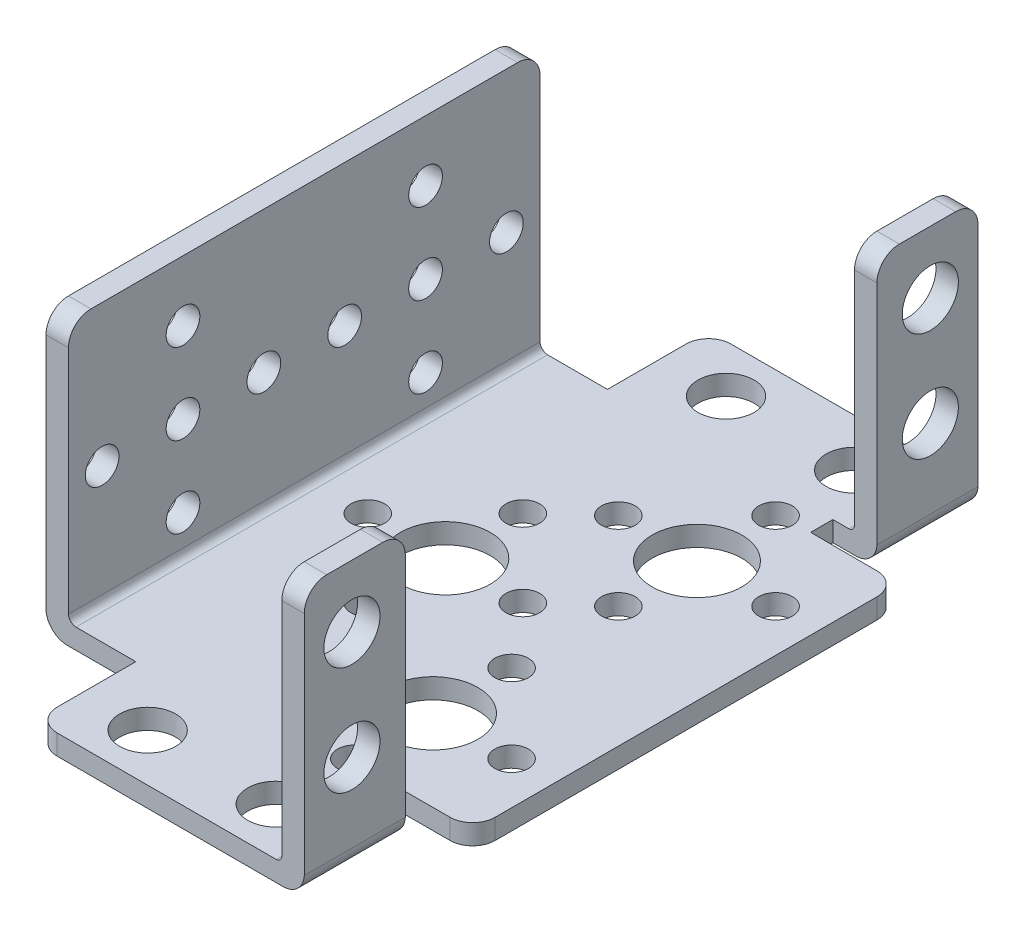
from build123d import *

# Parameters (mm, degrees)
BOSS_EXTRUDE1_DEPTH  = 42
FILLET1_R            = 2
BOSS_EXTRUDE2_DEPTH  = 9
FILLET2_R            = 2
CUT_EXTRUDE1_DEPTH   = 9
FILLET3_R            = 2
FILLET2_OF_MIRROR3_R = 2
FILLET3_OF_MIRROR3_R = 2
SKETCH5_R            = 1.5
CUT_EXTRUDE2_DEPTH   = 9
SKETCH7_R            = 2.5
CUT_EXTRUDE3_DEPTH   = 9
SKETCH8_R            = 2.5
CUT_EXTRUDE4_DEPTH   = 9
SKETCH9_R            = 4
SKETCH9_R_2          = 1.5
CUT_EXTRUDE5_DEPTH   = 9
SKETCH10_R           = 1.5
SKETCH10_R_2         = 4
CUT_EXTRUDE6_DEPTH   = 9


with BuildPart() as part:
    # Sketch2 → Boss-Extrude1 (new body)
    with BuildSketch(Plane.XY):
        with BuildLine():
            ThreePointArc((0, 1.792201759), (0.553343721, 0.553343721), (1.792201759, 0))
            Line((1.792201759, 0), (2, 0))
            Line((2, 0), (36, 0))
            Line((36, 0), (36, 1.792224077))
            Line((36, 1.792224077), (2.665691545, 1.792224077))
            ThreePointArc((2.665691545, 1.792224077), (2.206352155, 1.99856094), (2, 2.45789346))
            Line((2, 2.45789346), (2, 25))
            Line((2, 25), (0, 25))
            Line((0, 25), (0, 1.792201759))
        make_face()
    extrude(amount=BOSS_EXTRUDE1_DEPTH)

    # Fillet1
    fillet1_edges = [part.edges().sort_by_distance(p)[0] for p in [
        (1, 25, 0),
        (1, 25, 42),
        (36, 0.896112038, 42),
        (36, 0.896112038, 0),
    ]]
    fillet(fillet1_edges, radius=FILLET1_R)

    # Sketch3 → Boss-Extrude2 (add)
    with BuildSketch(Plane(origin=(0, 0, 0), x_dir=(-1, 0, 0), z_dir=(0, 0, -1))):
        with BuildLine():
            Line((-32, 1.792224077), (-29.505638958, 1.792224077))
            ThreePointArc((-29.505638958, 1.792224077), (-29.847420209, 1.944803868), (-30, 2.286585119))
            Line((-30, 2.286585119), (-30, 24))
            Line((-30, 24), (-32, 24))
            Line((-32, 24), (-32, 1.792224077))
        make_face()
        with BuildLine():
            Line((-8, 0), (-8, 1.792224077))
            Line((-8, 1.792224077), (-29.505638958, 1.792224077))
            Line((-29.505638958, 1.792224077), (-32, 1.792224077))
            ThreePointArc((-32, 1.792224077), (-31.446652567, 0.553347433), (-30.207775923, 0))
            Line((-30.207775923, 0), (-30, 0))
            Line((-30, 0), (-8, 0))
        make_face()
    boss_extrude2 = extrude(amount=BOSS_EXTRUDE2_DEPTH)

    # Fillet2
    fillet2_edges = [part.edges().sort_by_distance(p)[0] for p in [
        (8, 0.896112038, -9),
        (31, 24, -9),
        (31, 24, 0),
    ]]
    fillet(fillet2_edges, radius=FILLET2_R)

    # Sketch4 → Cut-Extrude1 (cut)
    with BuildSketch(Plane(origin=(0, 1.792224077, 0), x_dir=(1, 0, 0), z_dir=(0, 1, 0))):
        with BuildLine():
            Line((28.075602478, 0), (28.075602478, -1.97807902))
            Line((28.075602478, -1.97807902), (36, -2))
            ThreePointArc((36, -2), (35.415834928, -0.584165072), (34, 0))
            Line((34, 0), (28.075602478, 0))
        make_face()
    cut_extrude1 = extrude(amount=-CUT_EXTRUDE1_DEPTH, mode=Mode.SUBTRACT)

    # Fillet3
    fillet3_edges = [part.edges().sort_by_distance(p)[0] for p in [
        (36, 0.896112038, 2),
    ]]
    fillet(fillet3_edges, radius=FILLET3_R)

    # Mirror3: Boss-Extrude2, Cut-Extrude1 across plane
    add(boss_extrude2.mirror(Plane(origin=(0, 0, 21), x_dir=(1, 0, 0), z_dir=(0, 0, -1))))
    add(cut_extrude1.mirror(Plane(origin=(0, 0, 21), x_dir=(1, 0, 0), z_dir=(0, 0, -1))), mode=Mode.SUBTRACT)

    # Fillet2 of Mirror3
    fillet2_of_mirror3_edges = [part.edges().sort_by_distance(p)[0] for p in [
        (8, 0.896112038, 51),
        (31, 24, 51),
        (31, 24, 42),
    ]]
    fillet(fillet2_of_mirror3_edges, radius=FILLET2_OF_MIRROR3_R)

    # Fillet3 of Mirror3
    fillet3_of_mirror3_edges = [part.edges().sort_by_distance(p)[0] for p in [
        (36, 0.896112038, 40),
    ]]
    fillet(fillet3_of_mirror3_edges, radius=FILLET3_OF_MIRROR3_R)

    # Sketch5 → Cut-Extrude2 (cut)
    with BuildSketch(Plane.ZY):
        with Locations((39, 12.396100879)):
            Circle(SKETCH5_R)
        with Locations((31.8, 12.396100879)):
            Circle(SKETCH5_R)
        with Locations((24.6, 12.396100879)):
            Circle(SKETCH5_R)
        with Locations((17.4, 12.396100879)):
            Circle(SKETCH5_R)
        with Locations((10.2, 12.396100879)):
            Circle(SKETCH5_R)
        with Locations((3, 12.396100879)):
            Circle(SKETCH5_R)
        with Locations((31.8, 19.596100879)):
            Circle(SKETCH5_R)
        with Locations((31.8, 5.196100879)):
            Circle(SKETCH5_R)
        with Locations((10.2, 19.596100879)):
            Circle(SKETCH5_R)
        with Locations((10.2, 5.196100879)):
            Circle(SKETCH5_R)
    extrude(amount=-CUT_EXTRUDE2_DEPTH, mode=Mode.SUBTRACT)

    # Sketch7 → Cut-Extrude3 (cut)
    with BuildSketch(Plane(origin=(0, 1.792224077, 0), x_dir=(1, 0, 0), z_dir=(0, 1, 0))):
        with Locations(Location((25.217307954, -46.754456755, 0), (0, 0, 270))):
            Circle(SKETCH7_R)
        with Locations(Location((13.806043378, -46.754456755, 0), (0, 0, 270))):
            Circle(SKETCH7_R)
    cut_extrude3 = extrude(amount=-CUT_EXTRUDE3_DEPTH, mode=Mode.SUBTRACT)

    # Mirror4: Cut-Extrude3 across plane
    add(cut_extrude3.mirror(Plane(origin=(0, 0, 21), x_dir=(1, 0, 0), z_dir=(0, 0, -1))), mode=Mode.SUBTRACT)

    # Sketch8 → Cut-Extrude4 (cut)
    with BuildSketch(Plane.ZY.offset(-30)):
        with Locations((46.754456755, 18.460059087)):
            Circle(SKETCH8_R)
        with Locations((46.754456755, 8.801060864)):
            Circle(SKETCH8_R)
    cut_extrude4 = extrude(amount=-CUT_EXTRUDE4_DEPTH, mode=Mode.SUBTRACT)

    # Mirror5: Cut-Extrude4 across plane
    add(cut_extrude4.mirror(Plane(origin=(0, 0, 21), x_dir=(1, 0, 0), z_dir=(0, 0, -1))), mode=Mode.SUBTRACT)

    # Sketch9 → Cut-Extrude5 (cut)
    with BuildSketch(Plane(origin=(0, 1.792224077, 0), x_dir=(1, 0, 0), z_dir=(0, 1, 0))):
        with Locations(Location((25.217307954, -9.245543245, 0), (0, 0, 270))):
            Circle(SKETCH9_R)
        with Locations(Location((25.217307954, -2.245543245, 0), (0, 0, 270))):
            Circle(SKETCH9_R_2)
        with Locations(Location((32.217307954, -9.245543245, 0), (0, 0, 270))):
            Circle(SKETCH9_R_2)
        with Locations(Location((25.217307954, -16.245543245, 0), (0, 0, 270))):
            Circle(SKETCH9_R_2)
        with Locations(Location((18.217307954, -9.245543245, 0), (0, 0, 270))):
            Circle(SKETCH9_R_2)
    cut_extrude5 = extrude(amount=-CUT_EXTRUDE5_DEPTH, mode=Mode.SUBTRACT)

    # Mirror6: Cut-Extrude5 across plane
    add(cut_extrude5.mirror(Plane(origin=(0, 0, 21), x_dir=(1, 0, 0), z_dir=(0, 0, -1))), mode=Mode.SUBTRACT)

    # Sketch10 → Cut-Extrude6 (cut)
    with BuildSketch(Plane(origin=(0, 1.792224077, 0), x_dir=(1, 0, 0), z_dir=(0, 1, 0))):
        with BuildLine():
            ThreePointArc((15.306043378, -13.341463842), (14.86670355, -12.28080367), (13.806043378, -11.841463842))
            Line((13.806043378, -11.841463842), (13.806043378, -14.841463842))
            ThreePointArc((13.806043378, -14.841463842), (14.86670355, -14.402124014), (15.306043378, -13.341463842))
        make_face()
        with BuildLine():
            Line((13.806043378, -14.841463842), (13.806043378, -11.841463842))
            ThreePointArc((13.806043378, -11.841463842), (12.306043378, -13.341463842), (13.806043378, -14.841463842))
        make_face()
        with Locations(Location((6.901963975, -20.245543245, 0), (0, 0, 270))):
            Circle(SKETCH10_R)
        with Locations(Location((20.710122781, -20.245543245, 0), (0, 0, 270))):
            Circle(SKETCH10_R)
        with Locations(Location((13.806043378, -27.149622647, 0), (0, 0, 270))):
            Circle(SKETCH10_R)
        with Locations(Location((13.806043378, -20.245543245, 0), (0, 0, 270))):
            Circle(SKETCH10_R_2)
    extrude(amount=-CUT_EXTRUDE6_DEPTH, mode=Mode.SUBTRACT)


solid = part.part
